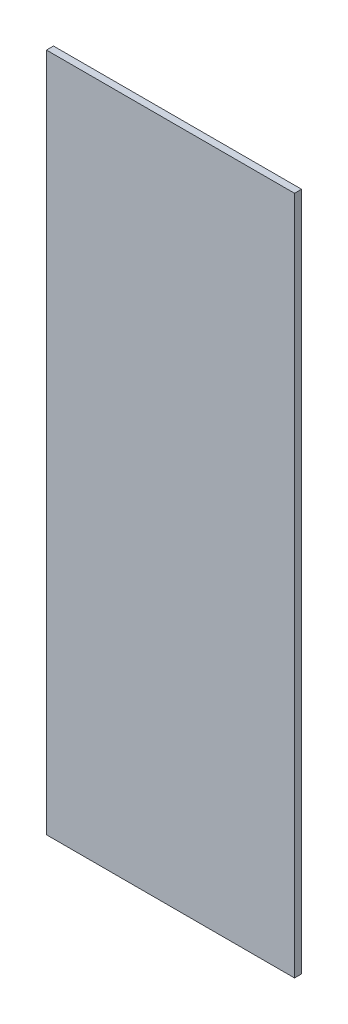
from build123d import *

# Parameters (mm, degrees)
SKETCH1_W           = 897.478004969
SKETCH1_H           = 2458.846264056
BOSS_EXTRUDE1_DEPTH = 25.4


with BuildPart() as part:
    # Sketch1 → Boss-Extrude1 (new body)
    with BuildSketch(Plane(origin=(0, 613.723915234, 0), x_dir=(1, 0, 0), z_dir=(0, 0, 1))):
        with Locations((238.939849267, 1202.919466215)):
            Rectangle(SKETCH1_W, SKETCH1_H)
    extrude(amount=BOSS_EXTRUDE1_DEPTH)


solid = part.part
